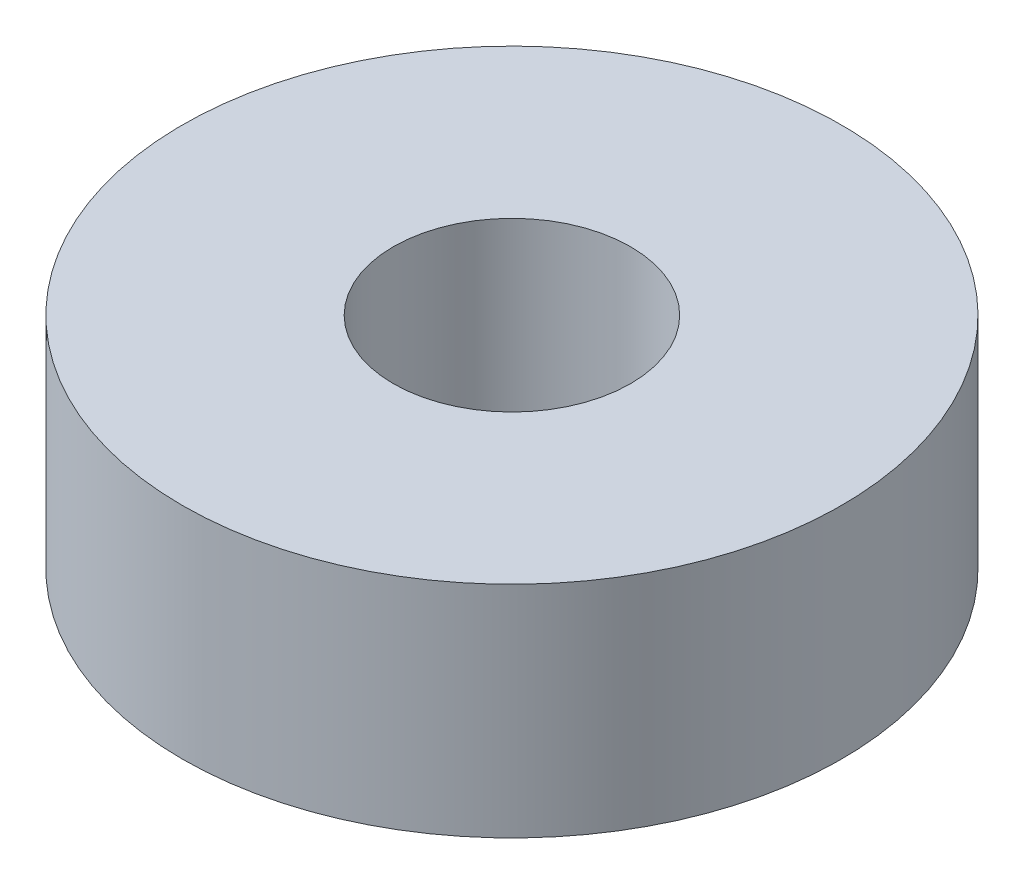
from build123d import *

# Parameters (mm, degrees)
SKETCH_1_R      = 7.5
SKETCH_1_R_2    = 2.7
EXTRUDE_1_DEPTH = 5


with BuildPart() as part:
    # 草圖1 → 填料-伸長1 (new body)
    with BuildSketch(Plane(origin=(0, 0, 0), x_dir=(1, 0, 0), z_dir=(0, 1, 0))):
        Circle(SKETCH_1_R)
        Circle(SKETCH_1_R_2, mode=Mode.SUBTRACT)
    extrude(amount=EXTRUDE_1_DEPTH)


solid = part.part
